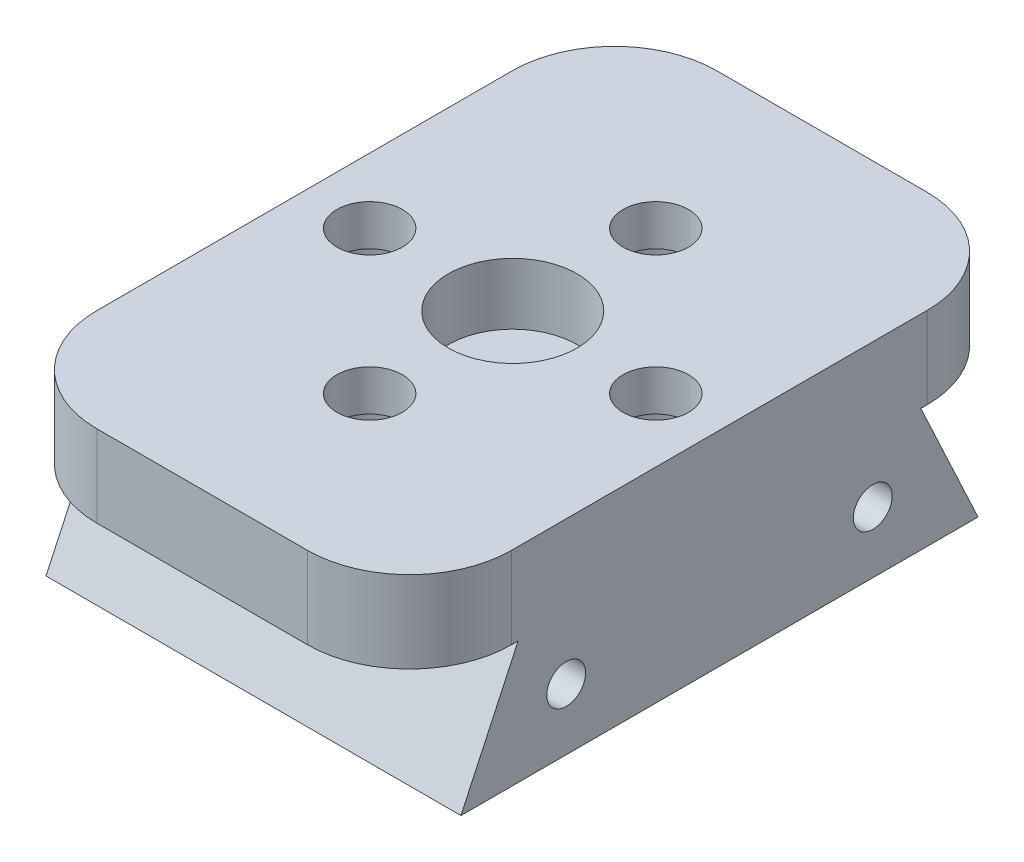
from build123d import *

# Parameters (mm, degrees)
SKETCH_1_W          = 20.3
SKETCH_1_H          = 30.33
EXTRUDE_1_DEPTH     = 10
CUT_EXTRUDE_1_DEPTH = 28.240910869
SKETCH_3_R          = 1.6
CUT_EXTRUDE_2_DEPTH = 21.825740083
SKETCH_4_R          = 3.1
CUT_EXTRUDE_3_DEPTH = 8
SKETCH_5_R          = 0.95
CUT_EXTRUDE_4_DEPTH = 5
SKETCH_6_R          = 3.15
CUT_EXTRUDE_5_DEPTH = 3
FILLET_2_R          = 5


with BuildPart() as part:
    # 草图1 → 凸台-拉伸1 (new body)
    with BuildSketch(Plane(origin=(0, 0, 0), x_dir=(1, 0, 0), z_dir=(0, 1, 0))):
        with Locations((-0.035, 0)):
            Rectangle(SKETCH_1_W, SKETCH_1_H)
    extrude(amount=EXTRUDE_1_DEPTH)

    # 草图2 → 切除-拉伸1 (cut, through all)
    with BuildSketch(Plane.ZY.offset(10.185)):
        Polygon((-15.165, 6), (-9.85, 6), (-12.647845949, 0), (-15.165, 0), align=None)
        Polygon((12.647845949, 0), (9.85, 6), (15.165, 6), (15.165, 0), align=None)
    extrude(amount=-CUT_EXTRUDE_1_DEPTH, mode=Mode.SUBTRACT)

    # 草图3 → 切除-拉伸2 (cut, through all)
    with BuildSketch(Plane.XZ):
        with Locations(Location((0, 7, 0), (0, 0, 270))):
            Circle(SKETCH_3_R)
        with Locations(Location((7, 0, 0), (0, 0, 270))):
            Circle(SKETCH_3_R)
        with Locations(Location((0, -7, 0), (0, 0, 270))):
            Circle(SKETCH_3_R)
        with Locations(Location((-7, 0, 0), (0, 0, 270))):
            Circle(SKETCH_3_R)
    extrude(amount=-CUT_EXTRUDE_2_DEPTH, mode=Mode.SUBTRACT)

    # 草图4 → 切除-拉伸3 (cut)
    with BuildSketch(Plane.XZ):
        with Locations(Location((0, 7, 0), (0, 0, 270))):
            Circle(SKETCH_4_R)
        with Locations(Location((7, 0, 0), (0, 0, 270))):
            Circle(SKETCH_4_R)
        with Locations(Location((0, -7, 0), (0, 0, 270))):
            Circle(SKETCH_4_R)
        with Locations(Location((-7, 0, 0), (0, 0, 270))):
            Circle(SKETCH_4_R)
    extrude(amount=-CUT_EXTRUDE_3_DEPTH, mode=Mode.SUBTRACT)

    # 草图5 → 切除-拉伸4 (cut)
    with BuildSketch(Plane(origin=(10.115, 0, 0), x_dir=(0, 0, -1), z_dir=(1, 0, 0))):
        with Locations((-7.5, 3)):
            Circle(SKETCH_5_R)
        with Locations((7.5, 3)):
            Circle(SKETCH_5_R)
    extrude(amount=-CUT_EXTRUDE_4_DEPTH, mode=Mode.SUBTRACT)

    # 草图6 → 切除-拉伸5 (cut)
    with BuildSketch(Plane(origin=(0, 10, 0), x_dir=(1, 0, 0), z_dir=(0, 1, 0))):
        with Locations(Location((0, 0, 0), (0, 0, 270))):
            Circle(SKETCH_6_R)
    extrude(amount=-CUT_EXTRUDE_5_DEPTH, mode=Mode.SUBTRACT)

    # 圆角2
    fillet_2_edges = [part.edges().sort_by_distance(p)[0] for p in [
        (-10.185, 8, -15.165),
        (10.115, 8, -15.165),
        (10.115, 8, 15.165),
        (-10.185, 8, 15.165),
    ]]
    fillet(fillet_2_edges, radius=FILLET_2_R)


solid = part.part
